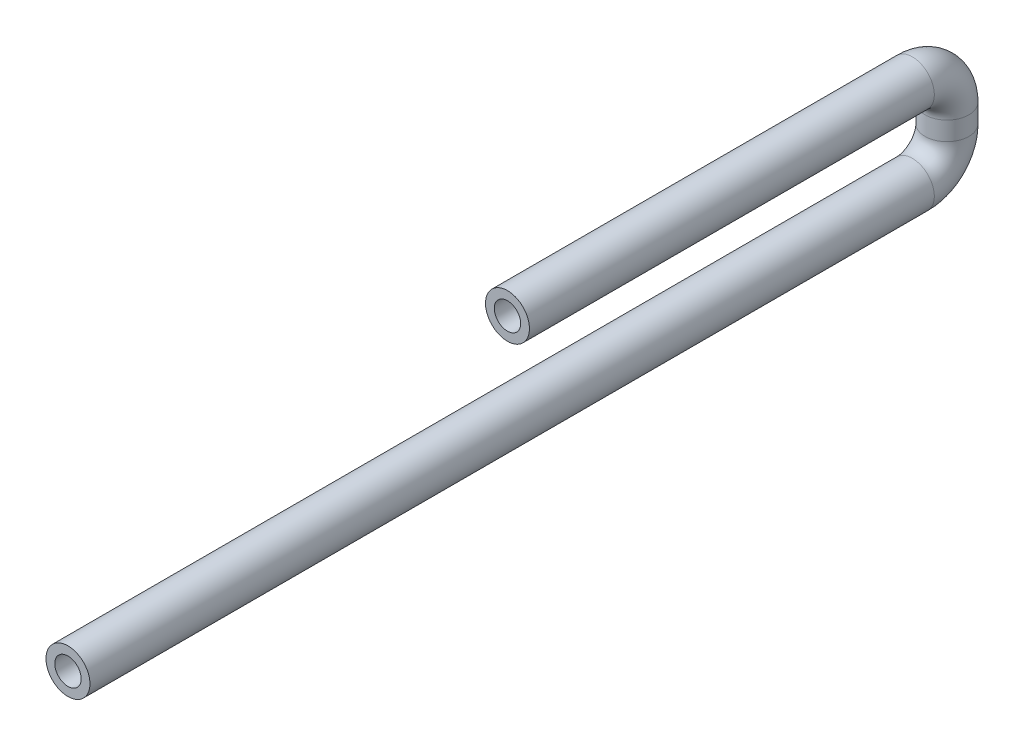
from build123d import *

# Parameters (mm, degrees)
SKETCH13_R   = 6.35
SKETCH13_R_2 = 3.81


with BuildPart() as part:
    # Sweep1: sweep along a path in Sketch14
    with BuildLine(Plane(origin=(0, 0, 0), x_dir=(0, 0, -1), z_dir=(1, 0, 0))) as sweep1_path:
        Line((0, -5.183219143), (117, -5.183219143))
        ThreePointArc((117, -5.183219143), (124.071067812, -8.112151331), (127, -15.183219143))
        Line((127, -15.183219143), (127, -20.583219143))
        ThreePointArc((127, -20.583219143), (124.071067812, -27.654286955), (117, -30.583219143))
        Line((117, -30.583219143), (-127, -30.583219143))
    # Sketch13 → Sweep1 (sweep)
    with BuildSketch(Plane.XY):
        with Locations((-0.83021259, -5.183219143)):
            Circle(SKETCH13_R)
        with Locations((-0.83021259, -5.183219143)):
            Circle(SKETCH13_R_2, mode=Mode.SUBTRACT)
    sweep(path=sweep1_path.line)


solid = part.part
